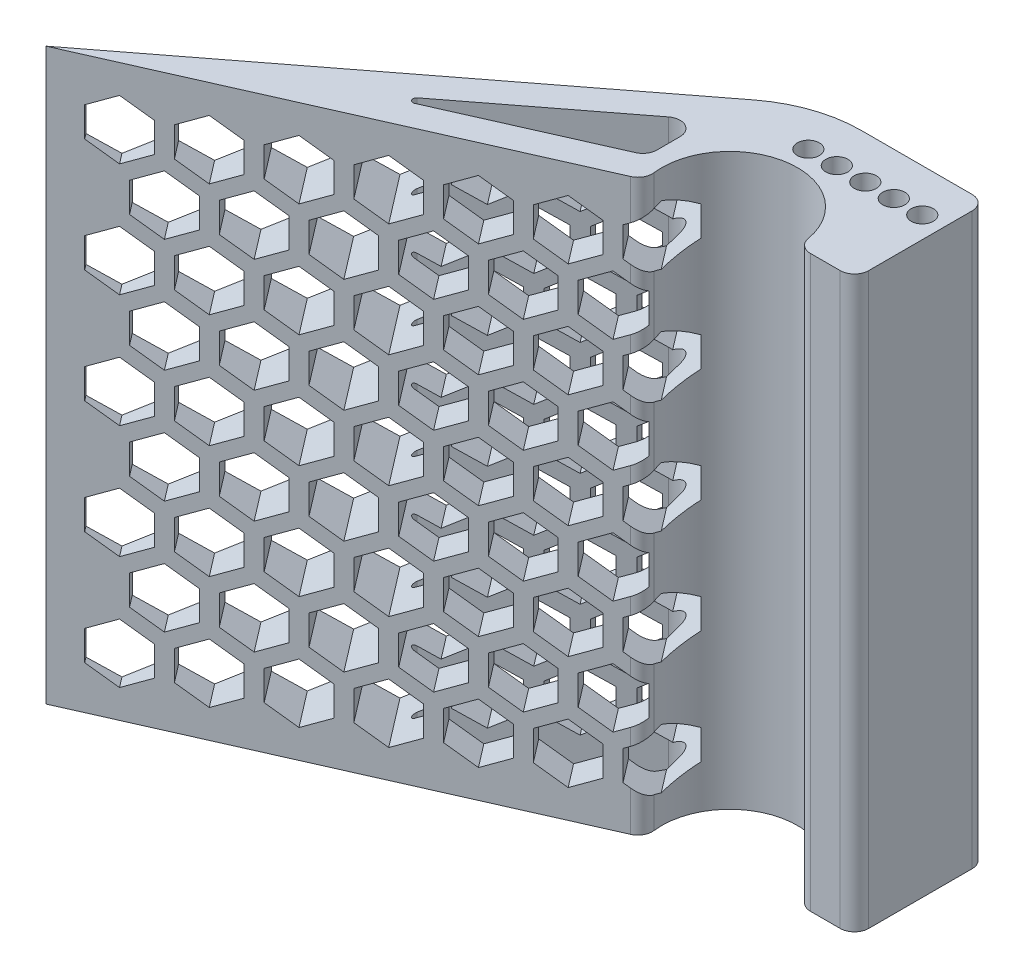
from build123d import *
from OCP.BRepFilletAPI import BRepFilletAPI_MakeFillet

# Parameters (mm, degrees)
SKETCH1_R           = 2.1
BOSS_EXTRUDE1_DEPTH = 160
FILLET1_R1          = 4
FILLET1_R2          = 1
SKETCH2_R           = 3.1
CUT_EXTRUDE1_DEPTH  = 4.7
CUT_EXTRUDE2_START  = -4.7
SKETCH3_R           = 3.1
CUT_EXTRUDE2_DEPTH  = 4.7
CUT_EXTRUDE3_DEPTH  = 37


with BuildPart() as part:
    # Sketch1 → Boss-Extrude1 (new body)
    with BuildSketch(Plane(origin=(0, 0, 0), x_dir=(1, 0, 0), z_dir=(0, 1, 0))):
        with BuildLine():
            Line((-9.914568138, 68.407296242), (-9.914568138, 85.5))
            Line((-9.914568138, 85.5), (-44.964568125, 85.5))
            ThreePointArc((-44.964568125, 85.5), (-56.873670454, 83.533799248), (-67.518743745, 77.84388903))
            Line((-67.518743745, 77.84388903), (-180.014510469, -8.47714881))
            Line((-180.014510469, -8.47714881), (-63.281704923, 43.217647212))
            ThreePointArc((-63.281704923, 43.217647212), (-47.60628178, 67.316659256), (-25.914568138, 48.45))
            Line((-25.914568138, 48.45), (-9.914568138, 48.45))
            Line((-9.914568138, 48.45), (-9.914568138, 68.407296242))
        make_face()
        Polygon((-68.964568125, 49.450365597), (-121.973490912, 25.975512594), (-68.964568125, 66.650689652), align=None, mode=Mode.SUBTRACT)
        with Locations((-47.914568138, 73.5)):
            Circle(SKETCH1_R, mode=Mode.SUBTRACT)
        with Locations((-39.914568138, 73.5)):
            Circle(SKETCH1_R, mode=Mode.SUBTRACT)
        with Locations((-31.914568138, 73.5)):
            Circle(SKETCH1_R, mode=Mode.SUBTRACT)
        with Locations((-23.914568138, 73.5)):
            Circle(SKETCH1_R, mode=Mode.SUBTRACT)
        with Locations((-15.914568138, 73.5)):
            Circle(SKETCH1_R, mode=Mode.SUBTRACT)
    extrude(amount=BOSS_EXTRUDE1_DEPTH)

    # Fillet1: one fillet with a radius per group of edges: ONE call of the kernel's fillet builder (fillet() takes one radius for all edges)
    fillet1_edges_1 = [part.edges().sort_by_distance(p)[0] for p in [
        (-25.914568138, 80, -48.45),
        (-9.914568138, 80, -48.45),
        (-9.914568138, 80, -85.5),
        (-63.281704923, 80, -43.217647212),
        (-68.964568125, 80, -66.650689652),
        (-68.964568125, 80, -49.450365597),
    ]]
    fillet1_edges_2 = [part.edges().sort_by_distance(p)[0] for p in [
        (-121.973490912, 80, -25.975512594),
    ]]
    fillet1 = BRepFilletAPI_MakeFillet(part.part.solid().wrapped)
    for e in fillet1_edges_1:
        fillet1.Add(FILLET1_R1, e.wrapped)
    for e in fillet1_edges_2:
        fillet1.Add(FILLET1_R2, e.wrapped)
    add(Compound.cast(fillet1.Shape()), mode=Mode.REPLACE)

    # Sketch2 → Cut-Extrude1 (cut)
    with BuildSketch(Plane(origin=(0, 160, 0), x_dir=(1, 0, 0), z_dir=(0, 1, 0))):
        with Locations((-47.914568138, 73.5)):
            Circle(SKETCH2_R)
        with Locations((-15.914568138, 73.5)):
            Circle(SKETCH2_R)
        with Locations((-31.914568138, 73.5)):
            Circle(SKETCH2_R)
        with Locations((-39.914568138, 73.5)):
            Circle(SKETCH2_R)
        with Locations((-23.914568138, 73.5)):
            Circle(SKETCH2_R)
    extrude(amount=-CUT_EXTRUDE1_DEPTH, mode=Mode.SUBTRACT)

    # Sketch3 → Cut-Extrude2 (cut)
    with BuildSketch(Plane.XZ.offset(CUT_EXTRUDE2_START)):
        with Locations((-47.914568138, -73.5)):
            Circle(SKETCH3_R)
        with Locations((-15.914568138, -73.5)):
            Circle(SKETCH3_R)
        with Locations((-39.914568138, -73.5)):
            Circle(SKETCH3_R)
        with Locations((-31.914568138, -73.5)):
            Circle(SKETCH3_R)
        with Locations((-23.914568138, -73.5)):
            Circle(SKETCH3_R)
    extrude(amount=CUT_EXTRUDE2_DEPTH, mode=Mode.SUBTRACT)

    # Sketch4 → Cut-Extrude3 (cut)
    with BuildSketch(Plane(origin=(-62.617514898, 0, -81.604734199), x_dir=(-0.7933533402912337, 0, 0.6087614290087227), z_dir=(-0.6087614290087225, 0, -0.7933533402912336))):
        Polygon((39.952746306, 152), (32.739875144, 147.835646893), (32.739875144, 139.506940679), (39.952746306, 135.342587571), (47.165617469, 139.506940679), (47.165617469, 147.835646893), align=None)
        Polygon((21.390734919, 152), (14.177863757, 147.835646893), (14.177863757, 139.506940679), (21.390734919, 135.342587571), (28.603606081, 139.506940679), (28.603606081, 147.835646893), align=None)
        Polygon((58.514757694, 152), (51.301886531, 147.835646893), (51.301886531, 139.506940679), (58.514757694, 135.342587571), (65.727628856, 139.506940679), (65.727628856, 147.835646893), align=None)
        Polygon((77.076769081, 152), (69.863897919, 147.835646893), (69.863897919, 139.506940679), (77.076769081, 135.342587571), (84.289640243, 139.506940679), (84.289640243, 147.835646893), align=None)
        Polygon((95.638780468, 152), (88.425909306, 147.835646893), (88.425909306, 139.506940679), (95.638780468, 135.342587571), (102.851651631, 139.506940679), (102.851651631, 147.835646893), align=None)
        Polygon((114.200791856, 152), (106.987920693, 147.835646893), (106.987920693, 139.506940679), (114.200791856, 135.342587571), (121.413663018, 139.506940679), (121.413663018, 147.835646893), align=None)
        Polygon((132.762803243, 152), (125.549932081, 147.835646893), (125.549932081, 139.506940679), (132.762803243, 135.342587571), (139.975674405, 139.506940679), (139.975674405, 147.835646893), align=None)
        Polygon((67.795763387, 136.082176554), (60.582892225, 131.917823446), (60.582892225, 123.589117232), (67.795763387, 119.424764125), (75.00863455, 123.589117232), (75.00863455, 131.917823446), align=None)
        Polygon((30.671740613, 136.082176554), (23.45886945, 131.917823446), (23.45886945, 123.589117232), (30.671740613, 119.424764125), (37.884611775, 123.589117232), (37.884611775, 131.917823446), align=None)
        Polygon((49.233752, 136.082176554), (42.020880838, 131.917823446), (42.020880838, 123.589117232), (49.233752, 119.424764125), (56.446623162, 123.589117232), (56.446623162, 131.917823446), align=None)
        Polygon((86.357774775, 136.082176554), (79.144903612, 131.917823446), (79.144903612, 123.589117232), (86.357774775, 119.424764125), (93.570645937, 123.589117232), (93.570645937, 131.917823446), align=None)
        Polygon((104.919786162, 136.082176554), (97.706915, 131.917823446), (97.706915, 123.589117232), (104.919786162, 119.424764125), (112.132657324, 123.589117232), (112.132657324, 131.917823446), align=None)
        Polygon((123.481797549, 136.082176554), (116.268926387, 131.917823446), (116.268926387, 123.589117232), (123.481797549, 119.424764125), (130.694668711, 123.589117232), (130.694668711, 131.917823446), align=None)
        Polygon((39.952746306, 120.164353107), (32.739875144, 116), (32.739875144, 107.671293786), (39.952746306, 103.506940679), (47.165617469, 107.671293786), (47.165617469, 116), align=None)
        Polygon((21.390734919, 120.164353107), (14.177863757, 116), (14.177863757, 107.671293786), (21.390734919, 103.506940679), (28.603606081, 107.671293786), (28.603606081, 116), align=None)
        Polygon((58.514757694, 120.164353107), (51.301886531, 116), (51.301886531, 107.671293786), (58.514757694, 103.506940679), (65.727628856, 107.671293786), (65.727628856, 116), align=None)
        Polygon((77.076769081, 120.164353107), (69.863897919, 116), (69.863897919, 107.671293786), (77.076769081, 103.506940679), (84.289640243, 107.671293786), (84.289640243, 116), align=None)
        Polygon((95.638780468, 120.164353107), (88.425909306, 116), (88.425909306, 107.671293786), (95.638780468, 103.506940679), (102.851651631, 107.671293786), (102.851651631, 116), align=None)
        Polygon((114.200791856, 120.164353107), (106.987920693, 116), (106.987920693, 107.671293786), (114.200791856, 103.506940679), (121.413663018, 107.671293786), (121.413663018, 116), align=None)
        Polygon((132.762803243, 120.164353107), (125.549932081, 116), (125.549932081, 107.671293786), (132.762803243, 103.506940679), (139.975674405, 107.671293786), (139.975674405, 116), align=None)
        Polygon((67.795763387, 104.246529661), (60.582892225, 100.082176554), (60.582892225, 91.753470339), (67.795763387, 87.589117232), (75.00863455, 91.753470339), (75.00863455, 100.082176554), align=None)
        Polygon((30.671740613, 104.246529661), (23.45886945, 100.082176554), (23.45886945, 91.753470339), (30.671740613, 87.589117232), (37.884611775, 91.753470339), (37.884611775, 100.082176554), align=None)
        Polygon((49.233752, 104.246529661), (42.020880838, 100.082176554), (42.020880838, 91.753470339), (49.233752, 87.589117232), (56.446623162, 91.753470339), (56.446623162, 100.082176554), align=None)
        Polygon((86.357774775, 104.246529661), (79.144903612, 100.082176554), (79.144903612, 91.753470339), (86.357774775, 87.589117232), (93.570645937, 91.753470339), (93.570645937, 100.082176554), align=None)
        Polygon((104.919786162, 104.246529661), (97.706915, 100.082176554), (97.706915, 91.753470339), (104.919786162, 87.589117232), (112.132657324, 91.753470339), (112.132657324, 100.082176554), align=None)
        Polygon((123.481797549, 104.246529661), (116.268926387, 100.082176554), (116.268926387, 91.753470339), (123.481797549, 87.589117232), (130.694668711, 91.753470339), (130.694668711, 100.082176554), align=None)
        Polygon((39.952746306, 88.328706214), (32.739875144, 84.164353107), (32.739875144, 75.835646893), (39.952746306, 71.671293786), (47.165617469, 75.835646893), (47.165617469, 84.164353107), align=None)
        Polygon((21.390734919, 88.328706214), (14.177863757, 84.164353107), (14.177863757, 75.835646893), (21.390734919, 71.671293786), (28.603606081, 75.835646893), (28.603606081, 84.164353107), align=None)
        Polygon((58.514757694, 88.328706214), (51.301886531, 84.164353107), (51.301886531, 75.835646893), (58.514757694, 71.671293786), (65.727628856, 75.835646893), (65.727628856, 84.164353107), align=None)
        Polygon((77.076769081, 88.328706214), (69.863897919, 84.164353107), (69.863897919, 75.835646893), (77.076769081, 71.671293786), (84.289640243, 75.835646893), (84.289640243, 84.164353107), align=None)
        Polygon((95.638780468, 88.328706214), (88.425909306, 84.164353107), (88.425909306, 75.835646893), (95.638780468, 71.671293786), (102.851651631, 75.835646893), (102.851651631, 84.164353107), align=None)
        Polygon((114.200791856, 88.328706214), (106.987920693, 84.164353107), (106.987920693, 75.835646893), (114.200791856, 71.671293786), (121.413663018, 75.835646893), (121.413663018, 84.164353107), align=None)
        Polygon((132.762803243, 88.328706214), (125.549932081, 84.164353107), (125.549932081, 75.835646893), (132.762803243, 71.671293786), (139.975674405, 75.835646893), (139.975674405, 84.164353107), align=None)
        Polygon((67.795763387, 72.410882768), (60.582892225, 68.246529661), (60.582892225, 59.917823446), (67.795763387, 55.753470339), (75.00863455, 59.917823446), (75.00863455, 68.246529661), align=None)
        Polygon((30.671740613, 72.410882768), (23.45886945, 68.246529661), (23.45886945, 59.917823446), (30.671740613, 55.753470339), (37.884611775, 59.917823446), (37.884611775, 68.246529661), align=None)
        Polygon((49.233752, 72.410882768), (42.020880838, 68.246529661), (42.020880838, 59.917823446), (49.233752, 55.753470339), (56.446623162, 59.917823446), (56.446623162, 68.246529661), align=None)
        Polygon((86.357774775, 72.410882768), (79.144903612, 68.246529661), (79.144903612, 59.917823446), (86.357774775, 55.753470339), (93.570645937, 59.917823446), (93.570645937, 68.246529661), align=None)
        Polygon((104.919786162, 72.410882768), (97.706915, 68.246529661), (97.706915, 59.917823446), (104.919786162, 55.753470339), (112.132657324, 59.917823446), (112.132657324, 68.246529661), align=None)
        Polygon((123.481797549, 72.410882768), (116.268926387, 68.246529661), (116.268926387, 59.917823446), (123.481797549, 55.753470339), (130.694668711, 59.917823446), (130.694668711, 68.246529661), align=None)
        Polygon((39.952746306, 56.493059321), (32.739875144, 52.328706214), (32.739875144, 44), (39.952746306, 39.835646893), (47.165617469, 44), (47.165617469, 52.328706214), align=None)
        Polygon((21.390734919, 56.493059321), (14.177863757, 52.328706214), (14.177863757, 44), (21.390734919, 39.835646893), (28.603606081, 44), (28.603606081, 52.328706214), align=None)
        Polygon((58.514757694, 56.493059321), (51.301886531, 52.328706214), (51.301886531, 44), (58.514757694, 39.835646893), (65.727628856, 44), (65.727628856, 52.328706214), align=None)
        Polygon((77.076769081, 56.493059321), (69.863897919, 52.328706214), (69.863897919, 44), (77.076769081, 39.835646893), (84.289640243, 44), (84.289640243, 52.328706214), align=None)
        Polygon((95.638780468, 56.493059321), (88.425909306, 52.328706214), (88.425909306, 44), (95.638780468, 39.835646893), (102.851651631, 44), (102.851651631, 52.328706214), align=None)
        Polygon((114.200791856, 56.493059321), (106.987920693, 52.328706214), (106.987920693, 44), (114.200791856, 39.835646893), (121.413663018, 44), (121.413663018, 52.328706214), align=None)
        Polygon((132.762803243, 56.493059321), (125.549932081, 52.328706214), (125.549932081, 44), (132.762803243, 39.835646893), (139.975674405, 44), (139.975674405, 52.328706214), align=None)
        Polygon((67.795763387, 40.575235875), (60.582892225, 36.410882768), (60.582892225, 28.082176554), (67.795763387, 23.917823446), (75.00863455, 28.082176554), (75.00863455, 36.410882768), align=None)
        Polygon((30.671740613, 40.575235875), (23.45886945, 36.410882768), (23.45886945, 28.082176554), (30.671740613, 23.917823446), (37.884611775, 28.082176554), (37.884611775, 36.410882768), align=None)
        Polygon((49.233752, 40.575235875), (42.020880838, 36.410882768), (42.020880838, 28.082176554), (49.233752, 23.917823446), (56.446623162, 28.082176554), (56.446623162, 36.410882768), align=None)
        Polygon((86.357774775, 40.575235875), (79.144903612, 36.410882768), (79.144903612, 28.082176554), (86.357774775, 23.917823446), (93.570645937, 28.082176554), (93.570645937, 36.410882768), align=None)
        Polygon((104.919786162, 40.575235875), (97.706915, 36.410882768), (97.706915, 28.082176554), (104.919786162, 23.917823446), (112.132657324, 28.082176554), (112.132657324, 36.410882768), align=None)
        Polygon((123.481797549, 40.575235875), (116.268926387, 36.410882768), (116.268926387, 28.082176554), (123.481797549, 23.917823446), (130.694668711, 28.082176554), (130.694668711, 36.410882768), align=None)
        Polygon((21.390734919, 24.657412429), (14.177863757, 20.493059321), (14.177863757, 12.164353107), (21.390734919, 8), (28.603606081, 12.164353107), (28.603606081, 20.493059321), align=None)
        Polygon((39.952746306, 24.657412429), (32.739875144, 20.493059321), (32.739875144, 12.164353107), (39.952746306, 8), (47.165617469, 12.164353107), (47.165617469, 20.493059321), align=None)
        Polygon((58.514757694, 24.657412429), (51.301886531, 20.493059321), (51.301886531, 12.164353107), (58.514757694, 8), (65.727628856, 12.164353107), (65.727628856, 20.493059321), align=None)
        Polygon((77.076769081, 24.657412429), (69.863897919, 20.493059321), (69.863897919, 12.164353107), (77.076769081, 8), (84.289640243, 12.164353107), (84.289640243, 20.493059321), align=None)
        Polygon((95.638780468, 24.657412429), (88.425909306, 20.493059321), (88.425909306, 12.164353107), (95.638780468, 8), (102.851651631, 12.164353107), (102.851651631, 20.493059321), align=None)
        Polygon((114.200791856, 24.657412429), (106.987920693, 20.493059321), (106.987920693, 12.164353107), (114.200791856, 8), (121.413663018, 12.164353107), (121.413663018, 20.493059321), align=None)
        Polygon((132.762803243, 24.657412429), (125.549932081, 20.493059321), (125.549932081, 12.164353107), (132.762803243, 8), (139.975674405, 12.164353107), (139.975674405, 20.493059321), align=None)
    extrude(amount=-CUT_EXTRUDE3_DEPTH, mode=Mode.SUBTRACT)


solid = part.part
